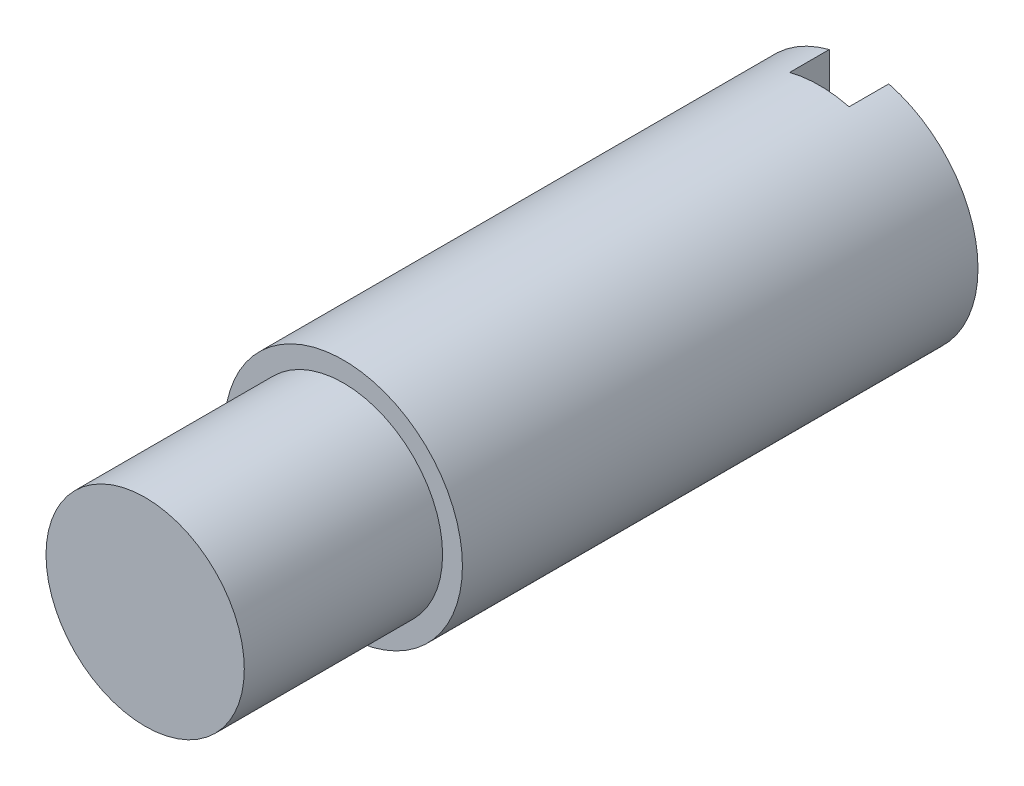
from build123d import *

# Parameters (mm, degrees)
SKETCH_1_R          = 3
EXTRUDE_1_DEPTH     = 13
SKETCH_2_R          = 2.5
EXTRUDE_2_DEPTH     = 5
SKETCH_3_W          = 1.5
SKETCH_3_H          = 7.126757192
CUT_EXTRUDE_1_DEPTH = 1


with BuildPart() as part:
    # Эскиз1 → Бобышка-Вытянуть1 (new body)
    with BuildSketch(Plane.XY):
        with Locations(Location((0, 0, 0), (0, 0, 180))):
            Circle(SKETCH_1_R)
    extrude(amount=EXTRUDE_1_DEPTH)

    # Эскиз2 → Бобышка-Вытянуть2 (add)
    with BuildSketch(Plane.XY.offset(13)):
        Circle(SKETCH_2_R)
    extrude(amount=EXTRUDE_2_DEPTH)

    # Эскиз3 → Вырез-Вытянуть1 (cut)
    with BuildSketch(Plane(origin=(0, 0, 0), x_dir=(-1, 0, 0), z_dir=(0, 0, -1))):
        with Locations((0, 0.049491369)):
            Rectangle(SKETCH_3_W, SKETCH_3_H)
    extrude(amount=-CUT_EXTRUDE_1_DEPTH, mode=Mode.SUBTRACT)


solid = part.part
